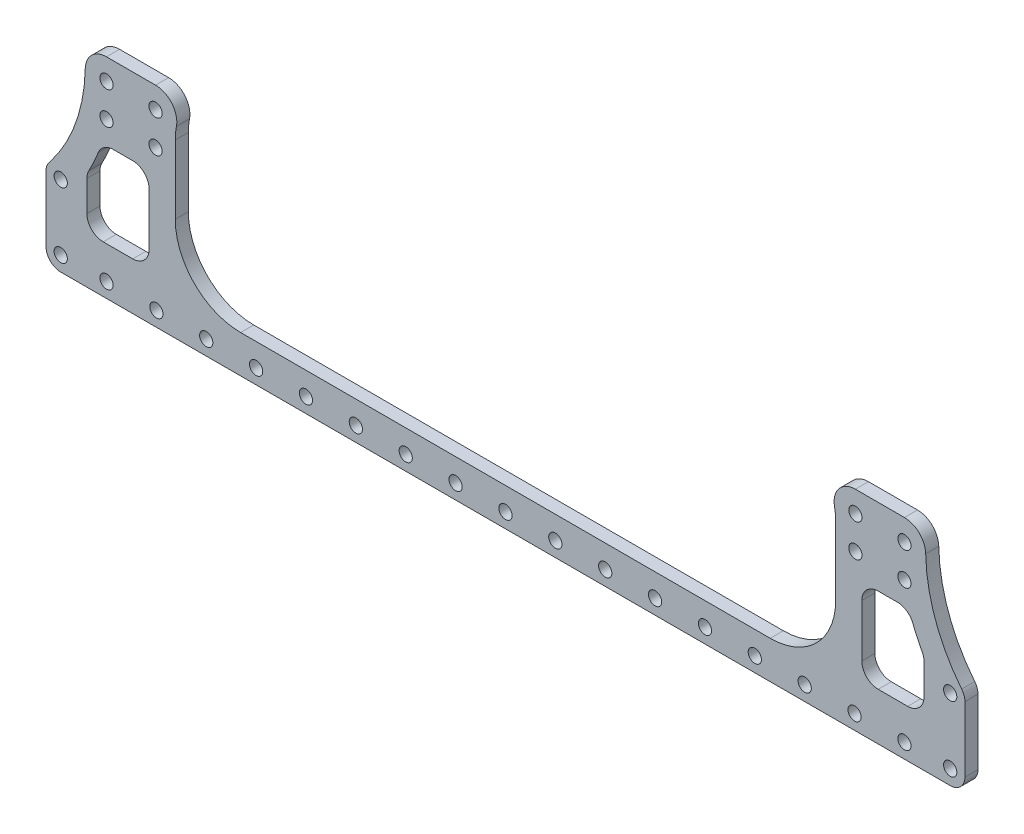
from build123d import *

# Parameters (mm, degrees)
SKETCH_1_R          = 2.025
EXTRUDE_1_DEPTH     = 4
EXTRUDE_START       = -4
SKETCH_3_R          = 2.025
SKETCH_3_R_2        = 4.5
EXTRUDE_2_DEPTH     = 4
CUT_EXTRUDE_START   = -4
CUT_EXTRUDE_1_DEPTH = 4
SKETCH_5_R          = 2.025
EXTRUDE_3_DEPTH     = 4
CUT_EXTRUDE_2_DEPTH = 4
FILLET_1_R          = 5


with BuildPart() as part:
    # 草图1 → 凸台-拉伸1 (new body)
    with BuildSketch(Plane.XY):
        with BuildLine():
            Line((-136, -32.5), (136, -32.5))
            ThreePointArc((136, -32.5), (140.057826276, -29.945262427), (139.508238663, -25.181798182))
            ThreePointArc((139.508238663, -25.181798182), (131.492529199, -10.937801452), (128.498696281, 5.130179301))
            ThreePointArc((128.498696281, 5.130179301), (126.549935963, 9.641991246), (122, 11.5))
            Line((122, 11.5), (107, 11.5))
            ThreePointArc((107, 11.5), (101.988927424, 9.13994585), (100.616747965, 3.773585121))
            ThreePointArc((100.616747965, 3.773585121), (96.394657773, -12.73829458), (80.975972641, -20))
            Line((80.975972641, -20), (-80.975972641, -20))
            ThreePointArc((-80.975972641, -20), (-96.394657597, -12.738294792), (-100.616748069, 3.773584578))
            ThreePointArc((-100.616748069, 3.773584578), (-101.988927248, 9.139945637), (-107, 11.5))
            Line((-107, 11.5), (-122, 11.5))
            ThreePointArc((-122, 11.5), (-126.549935963, 9.641991246), (-128.498696281, 5.130179301))
            ThreePointArc((-128.498696281, 5.130179301), (-131.492529192, -10.937801431), (-139.508238634, -25.181798147))
            ThreePointArc((-139.508238634, -25.181798147), (-140.057826286, -29.945262407), (-136, -32.5))
        make_face()
        with Locations((-122, -28)):
            Circle(SKETCH_1_R, mode=Mode.SUBTRACT)
        with Locations((122, -5)):
            Circle(SKETCH_1_R, mode=Mode.SUBTRACT)
        with Locations((107, -5)):
            Circle(SKETCH_1_R, mode=Mode.SUBTRACT)
        with Locations((-106.75, -28)):
            Circle(SKETCH_1_R, mode=Mode.SUBTRACT)
        with Locations((-91.5, -28)):
            Circle(SKETCH_1_R, mode=Mode.SUBTRACT)
        with Locations((-76.25, -28)):
            Circle(SKETCH_1_R, mode=Mode.SUBTRACT)
        with Locations((-61, -28)):
            Circle(SKETCH_1_R, mode=Mode.SUBTRACT)
        with Locations((-45.75, -28)):
            Circle(SKETCH_1_R, mode=Mode.SUBTRACT)
        with Locations((-30.5, -28)):
            Circle(SKETCH_1_R, mode=Mode.SUBTRACT)
        with Locations((-15.25, -28)):
            Circle(SKETCH_1_R, mode=Mode.SUBTRACT)
        with Locations((0, -28)):
            Circle(SKETCH_1_R, mode=Mode.SUBTRACT)
        with Locations((15.25, -28)):
            Circle(SKETCH_1_R, mode=Mode.SUBTRACT)
        with Locations((30.5, -28)):
            Circle(SKETCH_1_R, mode=Mode.SUBTRACT)
        with Locations((45.75, -28)):
            Circle(SKETCH_1_R, mode=Mode.SUBTRACT)
        with Locations((61, -28)):
            Circle(SKETCH_1_R, mode=Mode.SUBTRACT)
        with Locations((76.25, -28)):
            Circle(SKETCH_1_R, mode=Mode.SUBTRACT)
        with Locations((91.5, -28)):
            Circle(SKETCH_1_R, mode=Mode.SUBTRACT)
        with Locations((106.75, -28)):
            Circle(SKETCH_1_R, mode=Mode.SUBTRACT)
        with Locations((-122, -5)):
            Circle(SKETCH_1_R, mode=Mode.SUBTRACT)
        with Locations((-107, -5)):
            Circle(SKETCH_1_R, mode=Mode.SUBTRACT)
        with Locations((122, -28)):
            Circle(SKETCH_1_R, mode=Mode.SUBTRACT)
        with Locations((-136, -28)):
            Circle(SKETCH_1_R, mode=Mode.SUBTRACT)
        with Locations((-122, 5)):
            Circle(SKETCH_1_R, mode=Mode.SUBTRACT)
        with Locations((136, -28)):
            Circle(SKETCH_1_R, mode=Mode.SUBTRACT)
        with Locations((-107, 5)):
            Circle(SKETCH_1_R, mode=Mode.SUBTRACT)
        with Locations((122, 5)):
            Circle(SKETCH_1_R, mode=Mode.SUBTRACT)
        with Locations((107, 5)):
            Circle(SKETCH_1_R, mode=Mode.SUBTRACT)
    extrude(amount=EXTRUDE_1_DEPTH)

    # 草图3 → 凸台-拉伸2 (add)
    # profile 1 of 3: a face of its own
    with BuildSketch(Plane.XY.offset(4).offset(EXTRUDE_START)):
        with BuildLine():
            Line((140.5, -48), (140.5, -28))
            ThreePointArc((140.5, -28), (139.181980515, -31.181980515), (136, -32.5))
            Line((136, -32.5), (-136, -32.5))
            ThreePointArc((-136, -32.5), (-139.181980515, -31.181980515), (-140.5, -28))
            Line((-140.5, -28), (-140.5, -48))
            ThreePointArc((-140.5, -48), (-136, -43.5), (-131.5, -48))
            ThreePointArc((-131.5, -48), (-132.818019485, -51.181980515), (-136, -52.5))
            Line((-136, -52.5), (136, -52.5))
            ThreePointArc((136, -52.5), (132.818019485, -44.818019485), (140.5, -48))
        make_face()
        with Locations((-122, -48)):
            Circle(SKETCH_3_R, mode=Mode.SUBTRACT)
        with Locations((-106.75, -48)):
            Circle(SKETCH_3_R, mode=Mode.SUBTRACT)
        with Locations((-91.5, -48)):
            Circle(SKETCH_3_R, mode=Mode.SUBTRACT)
        with Locations((-76.25, -48)):
            Circle(SKETCH_3_R, mode=Mode.SUBTRACT)
        with Locations((-61, -48)):
            Circle(SKETCH_3_R, mode=Mode.SUBTRACT)
        with Locations((-45.75, -48)):
            Circle(SKETCH_3_R, mode=Mode.SUBTRACT)
        with Locations((-30.5, -48)):
            Circle(SKETCH_3_R, mode=Mode.SUBTRACT)
        with Locations((-15.25, -48)):
            Circle(SKETCH_3_R, mode=Mode.SUBTRACT)
        with Locations((0, -48)):
            Circle(SKETCH_3_R, mode=Mode.SUBTRACT)
        with Locations((15.25, -48)):
            Circle(SKETCH_3_R, mode=Mode.SUBTRACT)
        with Locations((30.5, -48)):
            Circle(SKETCH_3_R, mode=Mode.SUBTRACT)
        with Locations((45.75, -48)):
            Circle(SKETCH_3_R, mode=Mode.SUBTRACT)
        with Locations((61, -48)):
            Circle(SKETCH_3_R, mode=Mode.SUBTRACT)
        with Locations((76.25, -48)):
            Circle(SKETCH_3_R, mode=Mode.SUBTRACT)
        with Locations((91.5, -48)):
            Circle(SKETCH_3_R, mode=Mode.SUBTRACT)
        with Locations((106.75, -48)):
            Circle(SKETCH_3_R, mode=Mode.SUBTRACT)
        with Locations((122, -48)):
            Circle(SKETCH_3_R, mode=Mode.SUBTRACT)
    # profile 2 of 3: a face of its own
    with BuildSketch(Plane.XY.offset(4).offset(EXTRUDE_START)):
        with Locations((-136, -48)):
            Circle(SKETCH_3_R_2)
        with Locations((-136, -48)):
            Circle(SKETCH_3_R, mode=Mode.SUBTRACT)
    # profile 3 of 3: a face of its own
    with BuildSketch(Plane.XY.offset(4).offset(EXTRUDE_START)):
        with Locations((136, -48)):
            Circle(SKETCH_3_R_2)
        with Locations((136, -48)):
            Circle(SKETCH_3_R, mode=Mode.SUBTRACT)
    extrude(amount=EXTRUDE_2_DEPTH)

    # 草图4 → 切除-拉伸1 (cut)
    with BuildSketch(Plane.XY.offset(4).offset(CUT_EXTRUDE_START)):
        with BuildLine():
            ThreePointArc((61.000988285, -20), (66.484595805, -34.784048658), (80.975972382, -41))
            ThreePointArc((80.975972382, -41), (95.118108173, -35.142135715), (100.975972641, -21))
            ThreePointArc((100.975972641, -21), (100.217086052, -15.542935341), (97.998017171, -10.5))
            ThreePointArc((97.998017171, -10.5), (90.722766985, -17.464249197), (80.975972641, -20))
            Line((80.975972641, -20), (61.000988285, -20))
        make_face()
        with BuildLine():
            ThreePointArc((97.998017171, -10.5), (76.001792969, -1.628434844), (61.000988285, -20))
            Line((61.000988285, -20), (80.975972641, -20))
            ThreePointArc((80.975972641, -20), (90.722766985, -17.464249197), (97.998017171, -10.5))
        make_face()
        with BuildLine():
            ThreePointArc((-60.975972641, -21), (-66.833837017, -35.142135624), (-80.975972641, -41))
            Line((-80.975972641, -41), (80.975972382, -41))
            ThreePointArc((80.975972382, -41), (66.484595805, -34.784048658), (61.000988285, -20))
            Line((61.000988285, -20), (-61.000988285, -20))
            ThreePointArc((-61.000988285, -20), (-60.98222753, -20.499843579), (-60.975972641, -21))
        make_face()
        with BuildLine():
            ThreePointArc((-97.998017171, -10.5), (-100.217086052, -15.542935341), (-100.975972641, -21))
            ThreePointArc((-100.975972641, -21), (-95.118108264, -35.142135624), (-80.975972641, -41))
            ThreePointArc((-80.975972641, -41), (-66.833837017, -35.142135624), (-60.975972641, -21))
            ThreePointArc((-60.975972641, -21), (-60.98222753, -20.499843579), (-61.000988285, -20))
            Line((-61.000988285, -20), (-80.975972641, -20))
            ThreePointArc((-80.975972641, -20), (-90.722766985, -17.464249197), (-97.998017171, -10.5))
        make_face()
        with BuildLine():
            ThreePointArc((-61.000988285, -20), (-76.001792969, -1.628434844), (-97.998017171, -10.5))
            ThreePointArc((-97.998017171, -10.5), (-90.722766985, -17.464249197), (-80.975972641, -20))
            Line((-80.975972641, -20), (-61.000988285, -20))
        make_face()
        with BuildLine():
            ThreePointArc((-97.998017171, -10.5), (-100.217086052, -5.457064659), (-100.975972641, 0))
            Line((-100.975972641, 0), (-100.975972641, -21))
            ThreePointArc((-100.975972641, -21), (-100.217086052, -15.542935341), (-97.998017171, -10.5))
        make_face()
        with BuildLine():
            ThreePointArc((97.998017171, -10.5), (100.217086052, -15.542935341), (100.975972641, -21))
            Line((100.975972641, -21), (100.975972641, 0))
            ThreePointArc((100.975972641, 0), (100.217086052, -5.457064659), (97.998017171, -10.5))
        make_face()
    extrude(amount=CUT_EXTRUDE_1_DEPTH, mode=Mode.SUBTRACT)

    # 草图5 → 凸台-拉伸3 (add)
    with BuildSketch(Plane.XY.offset(4).offset(EXTRUDE_START)):
        with Locations((106.75, -28)):
            Circle(SKETCH_5_R)
        with Locations((122, -28)):
            Circle(SKETCH_5_R)
        with Locations((-122, -28)):
            Circle(SKETCH_5_R)
        with Locations((-106.75, -28)):
            Circle(SKETCH_5_R)
    extrude(amount=EXTRUDE_3_DEPTH)

    # 草图6 → 切除-拉伸2 (cut)
    with BuildSketch(Plane.XY.offset(4)):
        with BuildLine():
            Line((-108.975972641, -12), (-123.395594864, -12))
            ThreePointArc((-123.395594864, -12), (-125.441584863, -17.320672039), (-128, -22.414799835))
            Line((-128, -22.414799835), (-128, -38))
            Line((-128, -38), (-108.975972641, -38))
            Line((-108.975972641, -38), (-108.975972641, -12))
        make_face()
        with BuildLine():
            Line((128, -38), (128, -22.414799835))
            ThreePointArc((128, -22.414799835), (125.441584863, -17.320672039), (123.395594864, -12))
            Line((123.395594864, -12), (108.975972641, -12))
            Line((108.975972641, -12), (108.975972641, -38))
            Line((108.975972641, -38), (128, -38))
        make_face()
    extrude(amount=-CUT_EXTRUDE_2_DEPTH, mode=Mode.SUBTRACT)

    # 圆角1
    fillet_1_edges = [part.edges().sort_by_distance(p)[0] for p in [
        (-108.975972641, -12, 2),
        (-108.975972641, -38, 2),
        (-128, -38, 2),
        (-128, -22.414799835, 2),
        (-123.395594864, -12, 2),
        (123.395594864, -12, 2),
        (128, -22.414799835, 2),
        (128, -38, 2),
        (108.975972641, -38, 2),
        (108.975972641, -12, 2),
    ]]
    fillet(fillet_1_edges, radius=FILLET_1_R)


solid = part.part
